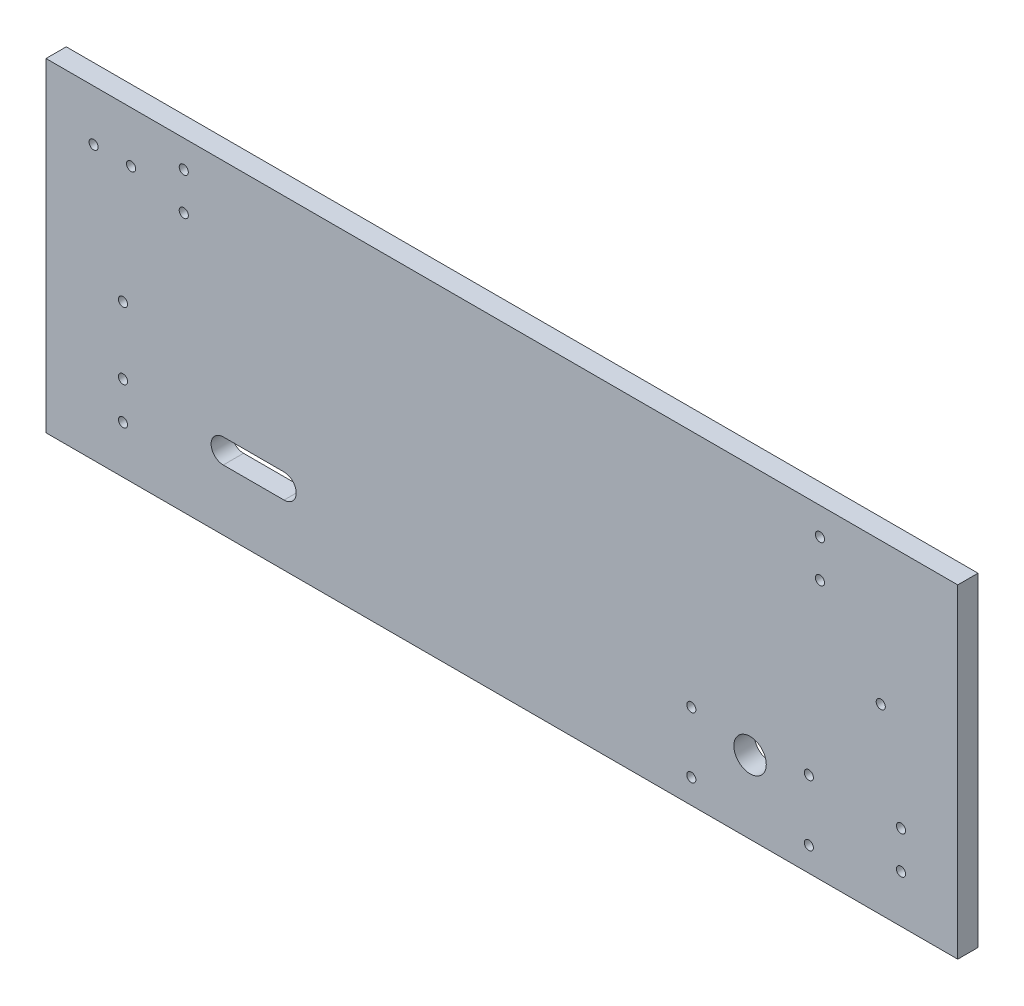
from build123d import *

# Parameters (mm, degrees)
SCHIZZO1_W                   = 450
SCHIZZO1_H                   = 160
ESTRUSIONE_ESTRUSIONE1_DEPTH = 10
SCHIZZO2_R                   = 8
SCHIZZO2_R_2                 = 2.25
TAGLIO_ESTRUSIONE1_DEPTH     = 10


with BuildPart() as part:
    # Schizzo1 → Estrusione-Estrusione1 (new body)
    with BuildSketch(Plane.XY):
        with Locations((225, 80)):
            Rectangle(SCHIZZO1_W, SCHIZZO1_H)
    extrude(amount=ESTRUSIONE_ESTRUSIONE1_DEPTH)

    # Schizzo2 → Taglio-Estrusione1 (cut)
    with BuildSketch(Plane.XY.offset(10)):
        with Locations((347.5, 36)):
            Circle(SCHIZZO2_R)
        with Locations((376.5, 42)):
            Circle(SCHIZZO2_R_2)
        with Locations((318.5, 42)):
            Circle(SCHIZZO2_R_2)
        with Locations((318.5, 12)):
            Circle(SCHIZZO2_R_2)
        with Locations((376.5, 12)):
            Circle(SCHIZZO2_R_2)
        with Locations((382, 146.5)):
            Circle(SCHIZZO2_R_2)
        with Locations((382, 128)):
            Circle(SCHIZZO2_R_2)
        with Locations((68, 146.5)):
            Circle(SCHIZZO2_R_2)
        with Locations((68, 128)):
            Circle(SCHIZZO2_R_2)
        with Locations((38, 42)):
            Circle(SCHIZZO2_R_2)
        with Locations((38, 23.5)):
            Circle(SCHIZZO2_R_2)
        with Locations((422, 23.5)):
            Circle(SCHIZZO2_R_2)
        with Locations((422, 42)):
            Circle(SCHIZZO2_R_2)
        with Locations((23.5, 134.933694222)):
            Circle(SCHIZZO2_R_2)
        with Locations((42, 134.933694222)):
            Circle(SCHIZZO2_R_2)
        with Locations((38, 75)):
            Circle(SCHIZZO2_R_2)
        with Locations((412, 90)):
            Circle(SCHIZZO2_R_2)
        with BuildLine():
            Line((87.5, 42), (117.5, 42))
            ThreePointArc((117.5, 42), (123.5, 36), (117.5, 30))
            Line((117.5, 30), (87.5, 30))
            ThreePointArc((87.5, 30), (81.5, 36), (87.5, 42))
        make_face()
    extrude(amount=-TAGLIO_ESTRUSIONE1_DEPTH, mode=Mode.SUBTRACT)


solid = part.part
